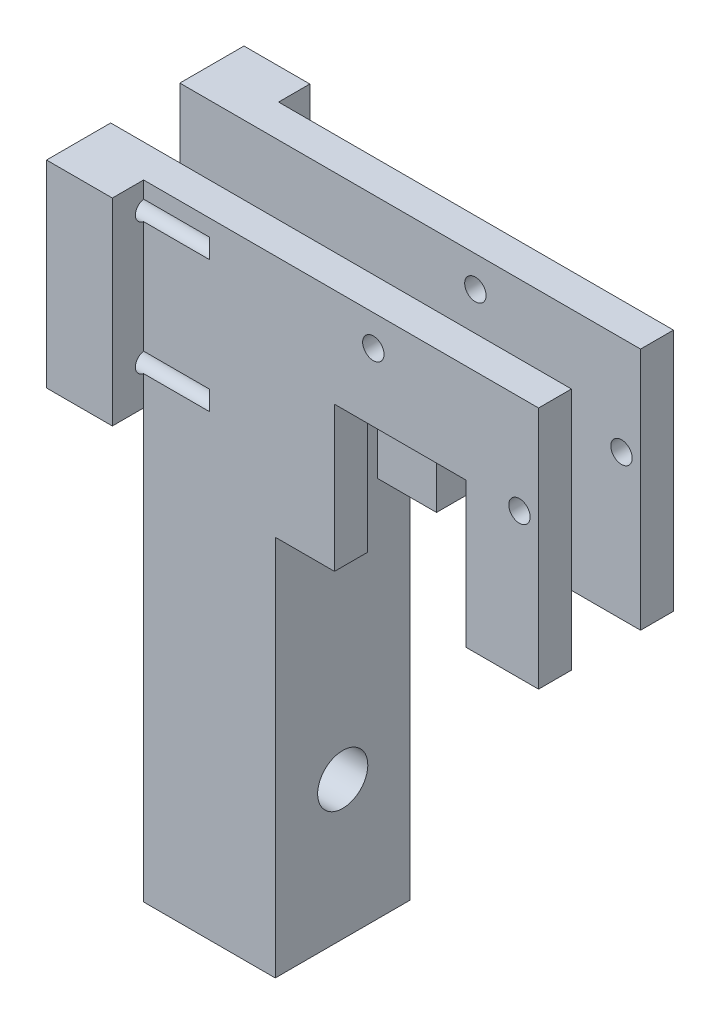
from build123d import *

# Parameters (mm, degrees)
SKETCH1_R           = 1.625
BOSS_EXTRUDE1_DEPTH = 5
BOSS_EXTRUDE2_START = 5
SKETCH1_3_W         = 20
SKETCH1_3_H         = 70
BOSS_EXTRUDE2_DEPTH = 10.5
BOSS_EXTRUDE3_START = 15.5
SKETCH1_4_R         = 1.625
BOSS_EXTRUDE3_DEPTH = 5
SKETCH1_5_W         = 9
SKETCH1_5_H         = 12
SKETCH1_5_W_2       = 11
BOSS_EXTRUDE4_DEPTH = 5
BOSS_EXTRUDE5_START = 15.5
SKETCH1_6_W         = 9
SKETCH1_6_H         = 12
SKETCH1_6_W_2       = 11
BOSS_EXTRUDE5_DEPTH = 5
SKETCH2_R           = 1.5
BOSS_EXTRUDE6_DEPTH = 10
CUT_EXTRUDE1_START  = 10
SKETCH2_3_R         = 1.5
CUT_EXTRUDE1_DEPTH  = 10
CUT_EXTRUDE2_START  = -120
SKETCH3_R           = 3.81
CUT_EXTRUDE2_DEPTH  = 20


with BuildPart() as part:
    # Sketch1 → Boss-Extrude1 (new body)
    with BuildSketch(Plane.XY):
        Polygon((20, 70), (29, 70), (29, 80), (49, 80), (49, 70), (60, 70), (60, 95), (0, 95), (0, 0), (20, 0), align=None)
        with Locations((34.9, 90.3)):
            Circle(SKETCH1_R, mode=Mode.SUBTRACT)
        with Locations((57.1, 80)):
            Circle(SKETCH1_R, mode=Mode.SUBTRACT)
    extrude(amount=BOSS_EXTRUDE1_DEPTH)

    # Sketch1<3> → Boss-Extrude2 (add)
    with BuildSketch(Plane.XY.offset(BOSS_EXTRUDE2_START)):
        with Locations((10, 35)):
            Rectangle(SKETCH1_3_W, SKETCH1_3_H)
    extrude(amount=BOSS_EXTRUDE2_DEPTH)

    # Sketch1<4> → Boss-Extrude3 (add)
    with BuildSketch(Plane.XY.offset(BOSS_EXTRUDE3_START)):
        Polygon((20, 70), (29, 70), (29, 80), (49, 80), (49, 70), (60, 70), (60, 95), (0, 95), (0, 0), (20, 0), align=None)
        with Locations((34.9, 90.3)):
            Circle(SKETCH1_4_R, mode=Mode.SUBTRACT)
        with Locations((57.1, 80)):
            Circle(SKETCH1_4_R, mode=Mode.SUBTRACT)
    extrude(amount=BOSS_EXTRUDE3_DEPTH)

    # Sketch1<5> → Boss-Extrude4 (add)
    with BuildSketch(Plane.XY):
        with Locations((24.5, 64)):
            Rectangle(SKETCH1_5_W, SKETCH1_5_H)
        with Locations((54.5, 64)):
            Rectangle(SKETCH1_5_W_2, SKETCH1_5_H)
    extrude(amount=BOSS_EXTRUDE4_DEPTH)

    # Sketch1<6> → Boss-Extrude5 (add)
    with BuildSketch(Plane.XY.offset(BOSS_EXTRUDE5_START)):
        with Locations((24.5, 64)):
            Rectangle(SKETCH1_6_W, SKETCH1_6_H)
        with Locations((54.5, 64)):
            Rectangle(SKETCH1_6_W_2, SKETCH1_6_H)
    extrude(amount=BOSS_EXTRUDE5_DEPTH)

    # Sketch2 → Boss-Extrude6 (add)
    with BuildSketch(Plane(origin=(0, 0, 0), x_dir=(0, 0, -1), z_dir=(1, 0, 0))):
        Polygon((4.75, 65), (4.75, 95), (-5, 95), (-5, 70), (-15.5, 70), (-15.5, 95), (-25.25, 95), (-25.25, 65), align=None)
        with Locations((-20.25, 71)):
            Circle(SKETCH2_R, mode=Mode.SUBTRACT)
        with Locations((-0.25, 71)):
            Circle(SKETCH2_R, mode=Mode.SUBTRACT)
        with Locations((-20.25, 91)):
            Circle(SKETCH2_R, mode=Mode.SUBTRACT)
        with Locations((-0.25, 91)):
            Circle(SKETCH2_R, mode=Mode.SUBTRACT)
    extrude(amount=-BOSS_EXTRUDE6_DEPTH)

    # Sketch2<3> → Cut-Extrude1 (cut)
    with BuildSketch(Plane(origin=(0, 0, 0), x_dir=(0, 0, -1), z_dir=(1, 0, 0)).offset(CUT_EXTRUDE1_START)):
        with Locations((-0.25, 91)):
            Circle(SKETCH2_3_R)
        with Locations((-20.25, 91)):
            Circle(SKETCH2_3_R)
        with Locations((-20.25, 71)):
            Circle(SKETCH2_3_R)
        with Locations((-0.25, 71)):
            Circle(SKETCH2_3_R)
    extrude(amount=-CUT_EXTRUDE1_DEPTH, mode=Mode.SUBTRACT)

    # Sketch3 → Cut-Extrude2 (cut)
    with BuildSketch(Plane.ZY.offset(100).offset(CUT_EXTRUDE2_START)):
        with Locations(Location((10.25, 21, 0), (0, 0, 90))):
            Circle(SKETCH3_R)
    extrude(amount=CUT_EXTRUDE2_DEPTH, mode=Mode.SUBTRACT)


solid = part.part
